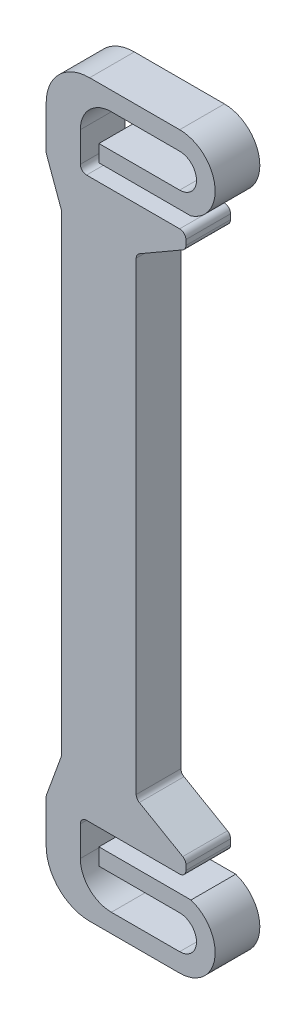
from build123d import *

# Parameters (mm, degrees)
BOSS_EXTRUDE1_DEPTH = 1.8


with BuildPart() as part:
    # Sketch1 → Boss-Extrude1 (new, symmetric)
    with BuildSketch(Plane.XY):
        with BuildLine():
            ThreePointArc((-4.21984631, 22.328989928), (-4.242403877, 22.413175911), (-4.25, 22.5))
            Line((-4.25, 22.5), (-1, 22.5))
            Line((-1, 22.5), (6.5, 22.5))
            ThreePointArc((6.5, 22.5), (6.853553391, 22.353553391), (7, 22))
            Line((7, 22), (7, 21.588675135))
            ThreePointArc((7, 21.588675135), (6.933012702, 21.338675135), (6.75, 21.155662433))
            Line((6.75, 21.155662433), (3.25, 19.134936491))
            ThreePointArc((3.25, 19.134936491), (3.066987298, 18.951923789), (3, 18.701923789))
            Line((3, 18.701923789), (3, 0))
            Line((3, 0), (0, 0))
            Line((0, 0), (-3, 0))
            Line((-3, 0), (-3, 18.889326245))
            ThreePointArc((-3, 18.889326245), (-3.007596123, 18.976150334), (-3.03015369, 19.060336317))
            Line((-3.03015369, 19.060336317), (-4.21984631, 22.328989928))
        make_face()
        with BuildLine():
            Line((-4.25, 23.85), (-4.25, 22.5))
            Line((-4.25, 22.5), (-1, 22.5))
            ThreePointArc((-1, 22.5), (-1.353553391, 22.646446609), (-1.5, 23))
            Line((-1.5, 23), (-1.5, 23.85))
            Line((-1.5, 23.85), (-4.25, 23.85))
        make_face()
        with BuildLine():
            Line((-4.25, 25.91183651), (-4.25, 23.85))
            Line((-4.25, 23.85), (-1.5, 23.85))
            Line((-1.5, 23.85), (-1.5, 25.41183651))
            ThreePointArc((-1.5, 25.41183651), (-0.767766953, 27.179603463), (1, 27.91183651))
            Line((1, 27.91183651), (6.5, 27.91183651))
            ThreePointArc((6.5, 27.91183651), (7.855918255, 26.555918255), (6.5, 25.2))
            Line((6.5, 25.2), (0, 25.2))
            Line((0, 25.2), (0, 23.85))
            Line((0, 23.85), (7.413386816, 23.85))
            ThreePointArc((7.413386816, 23.85), (9.318168769, 27.01872909), (6.5, 29.41183651))
            Line((6.5, 29.41183651), (-0.75, 29.41183651))
            ThreePointArc((-0.75, 29.41183651), (-3.224873734, 28.386710244), (-4.25, 25.91183651))
        make_face()
    extrude(amount=BOSS_EXTRUDE1_DEPTH, both=True)

    # Mirror1: part across plane


with BuildPart() as part_1:
    add(part.part)
    add(part.part.mirror(Plane.ZX))


solid = part_1.part
